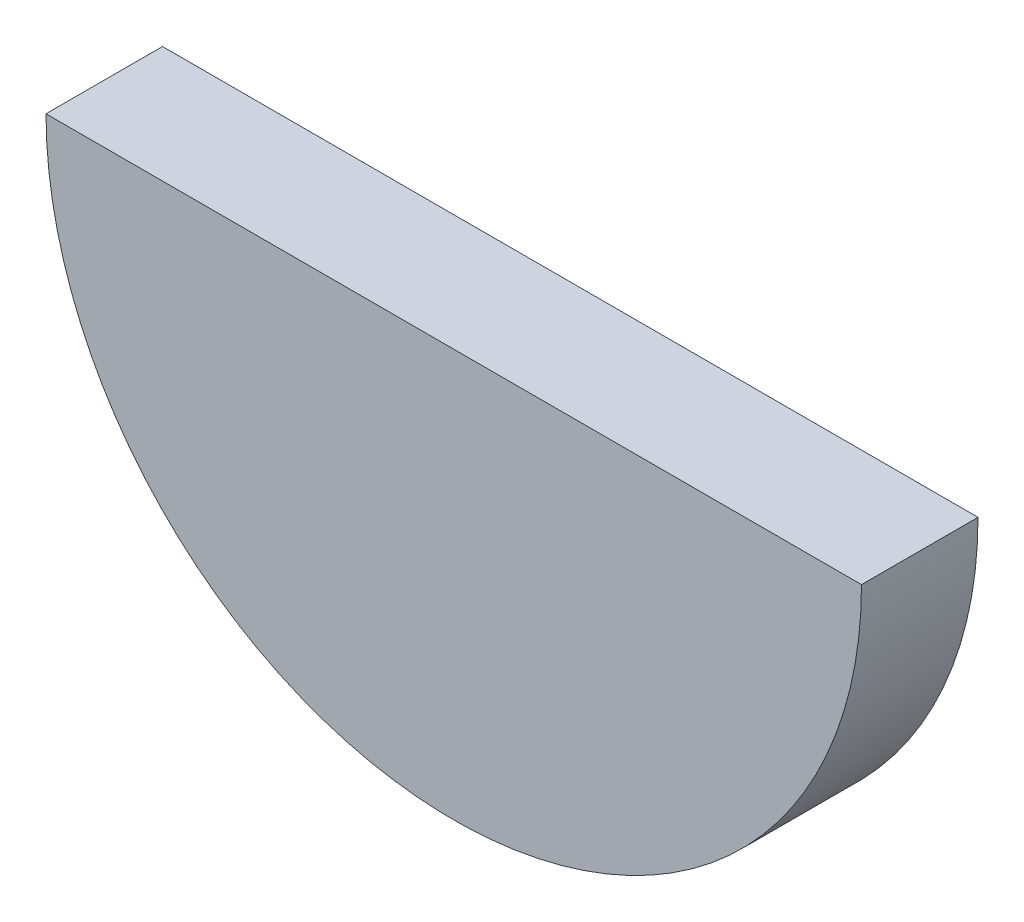
from build123d import *

# Parameters (mm, degrees)
BOSS_EXTRUDE1_DEPTH = 6.35


with BuildPart() as part:
    # Sketch1 → Boss-Extrude1 (new body)
    with BuildSketch(Plane.XY):
        with BuildLine():
            Line((-22.225, 0), (22.225, 0))
            ThreePointArc((22.225, 0), (0, -22.225), (-22.225, 0))
        make_face()
    extrude(amount=BOSS_EXTRUDE1_DEPTH)


solid = part.part
